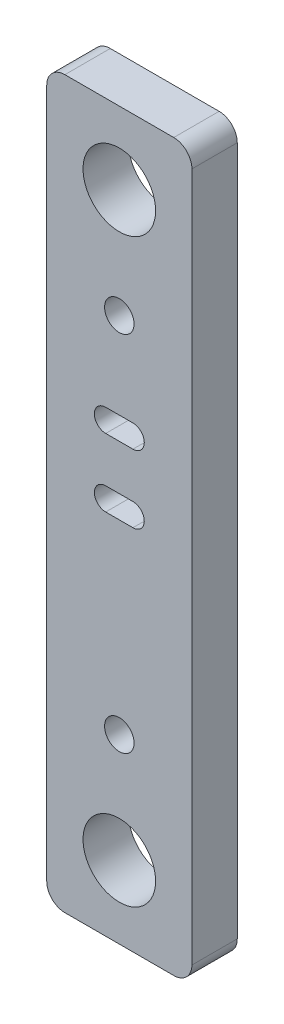
from build123d import *

# Parameters (mm, degrees)
SKETCH1_W           = 16
SKETCH1_H           = 80
SKETCH1_R           = 4
SKETCH1_R_2         = 1.625
BOSS_EXTRUDE1_DEPTH = 5
FILLET1_R           = 2


with BuildPart() as part:
    # Sketch1 → Boss-Extrude1 (new body)
    with BuildSketch(Plane.XY):
        with Locations((8, 40)):
            Rectangle(SKETCH1_W, SKETCH1_H)
        with Locations((8, 72)):
            Circle(SKETCH1_R, mode=Mode.SUBTRACT)
        with Locations((8, 8)):
            Circle(SKETCH1_R, mode=Mode.SUBTRACT)
        with Locations((8, 20)):
            Circle(SKETCH1_R_2, mode=Mode.SUBTRACT)
        with Locations((8, 60)):
            Circle(SKETCH1_R_2, mode=Mode.SUBTRACT)
        with BuildLine():
            Line((6.5, 50.5), (9.5, 50.5))
            ThreePointArc((9.5, 50.5), (10.75, 49.25), (9.5, 48))
            Line((9.5, 48), (6.5, 48))
            ThreePointArc((6.5, 48), (5.25, 49.25), (6.5, 50.5))
        make_face(mode=Mode.SUBTRACT)
        with BuildLine():
            Line((6.5, 43), (9.5, 43))
            ThreePointArc((9.5, 43), (10.75, 41.75), (9.5, 40.5))
            Line((9.5, 40.5), (6.5, 40.5))
            ThreePointArc((6.5, 40.5), (5.25, 41.75), (6.5, 43))
        make_face(mode=Mode.SUBTRACT)
    extrude(amount=BOSS_EXTRUDE1_DEPTH)

    # Fillet1
    fillet1_edges = [part.edges().sort_by_distance(p)[0] for p in [
        (0, 80, 2.5),
        (16, 80, 2.5),
        (16, 0, 2.5),
        (0, 0, 2.5),
    ]]
    fillet(fillet1_edges, radius=FILLET1_R)


solid = part.part
